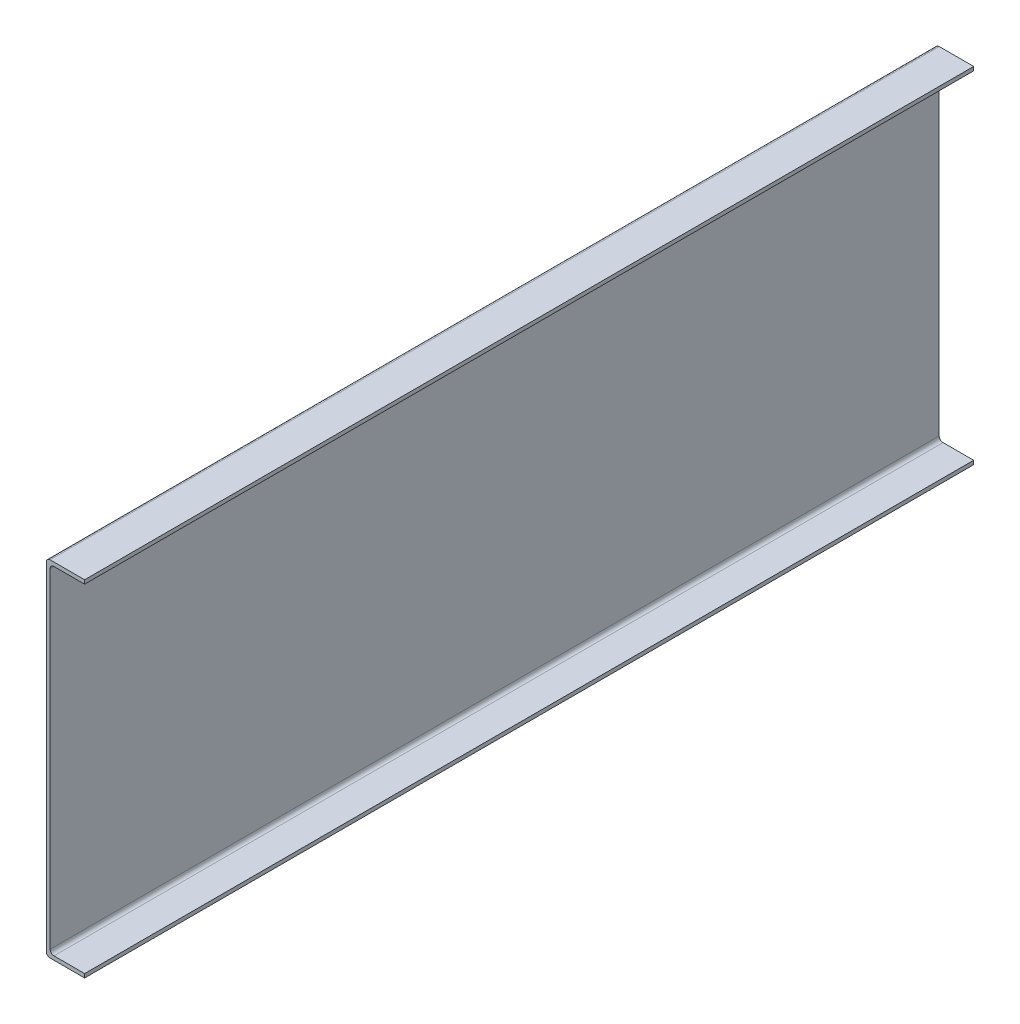
from build123d import *

# Parameters (mm, degrees)
BOSS_EXTRUDE1_DEPTH = 232
FILLET1_R           = 1


with BuildPart() as part:
    # Sketch1 → Boss-Extrude1 (new body)
    with BuildSketch(Plane.XY):
        Polygon((0, -45), (0, 45), (10, 45), (10, 44), (1, 44), (1, -44), (10, -44), (10, -45), align=None)
    extrude(amount=BOSS_EXTRUDE1_DEPTH)

    # Fillet1
    fillet1_edges = [part.edges().sort_by_distance(p)[0] for p in [
        (1, 44, 116),
        (1, -44, 116),
        (0, -45, 116),
        (0, 45, 116),
    ]]
    fillet(fillet1_edges, radius=FILLET1_R)


solid = part.part
